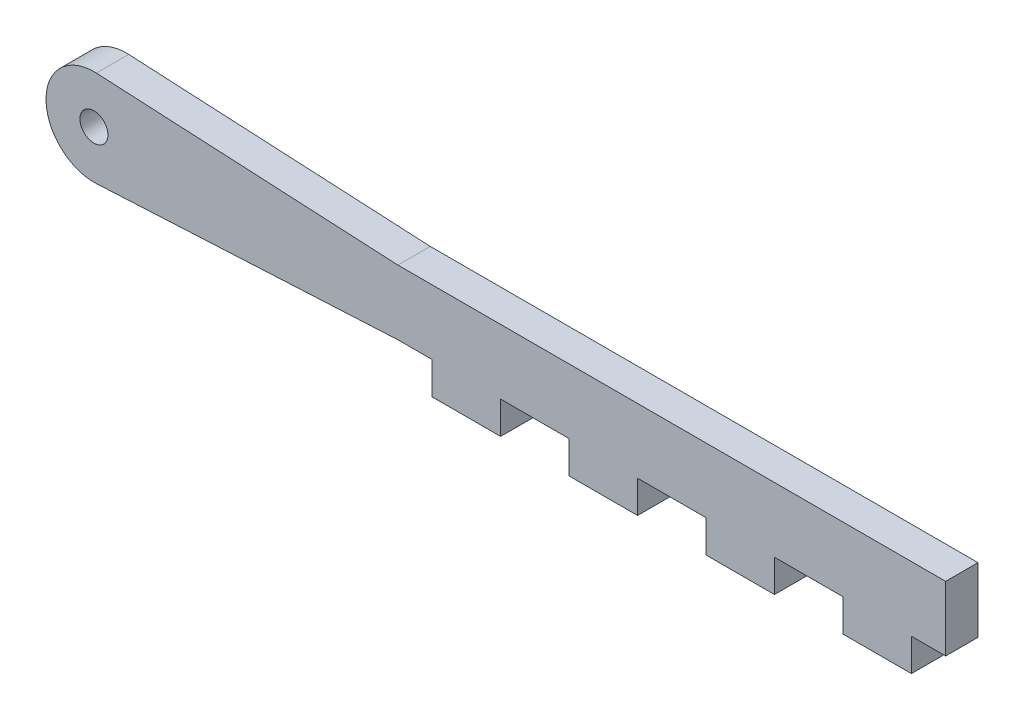
from build123d import *

# Parameters (mm, degrees)
SKETCH2_R           = 1.3
BOSS_EXTRUDE1_DEPTH = 3
SKETCH3_W           = 6.35
SKETCH3_H           = 3
BOSS_EXTRUDE2_DEPTH = 3
LPATTERN1_COUNT     = 4
LPATTERN1_PITCH     = 12.7


with BuildPart() as part:
    # Sketch2 → Boss-Extrude1 (new body)
    with BuildSketch(Plane.XY):
        with BuildLine():
            Line((0, 6), (-27.965559662, 7.439126041))
            ThreePointArc((-27.965559662, 7.439126041), (-32.639, 3), (-27.965559662, -1.439126041))
            Line((-27.965559662, -1.439126041), (0, 0))
            Line((0, 0), (50.8, 0))
            Line((50.8, 0), (50.8, 6))
            Line((50.8, 6), (0, 6))
        make_face()
        with Locations((-28.194, 3)):
            Circle(SKETCH2_R, mode=Mode.SUBTRACT)
    extrude(amount=BOSS_EXTRUDE1_DEPTH)

    # Sketch3 → Boss-Extrude2 (add)
    with BuildSketch(Plane.XZ):
        with Locations((6.35, 1.5)):
            Rectangle(SKETCH3_W, SKETCH3_H)
    boss_extrude2 = extrude(amount=BOSS_EXTRUDE2_DEPTH)

    # LPattern1: Boss-Extrude2 ×4
    with Locations(*[(i * LPATTERN1_PITCH, 0, 0) for i in range(1, LPATTERN1_COUNT)]):
        add(boss_extrude2)


solid = part.part
